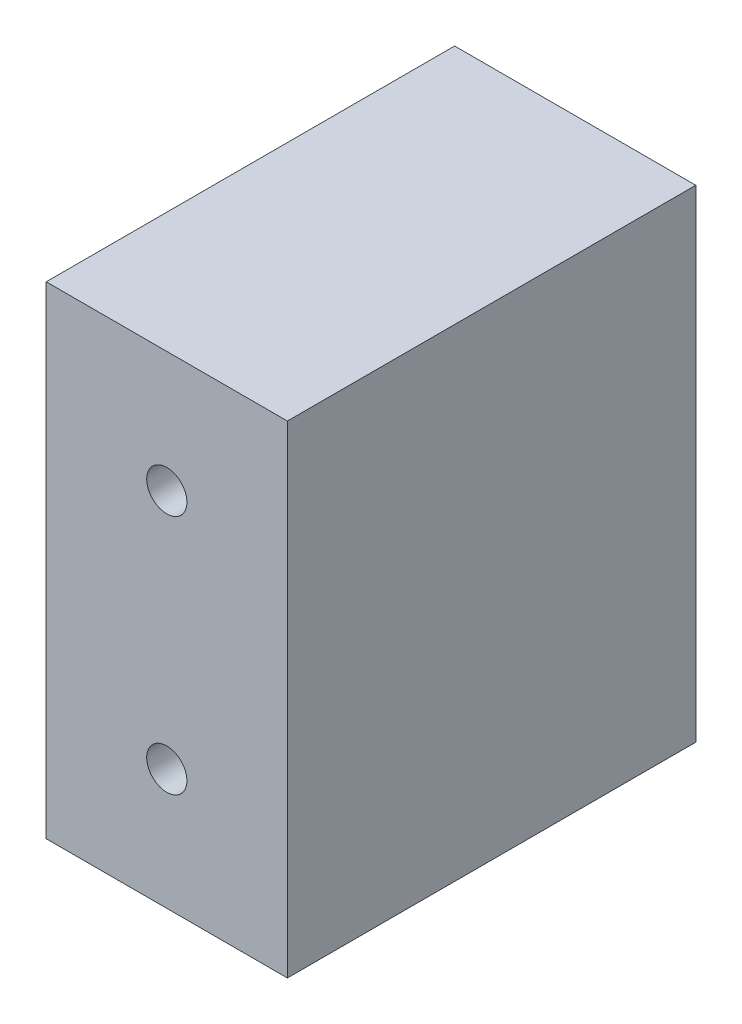
from build123d import *

# Parameters (mm, degrees)
SKETCH1_W           = 15
SKETCH1_H           = 30
SKETCH1_R           = 1.25
BOSS_EXTRUDE1_DEPTH = 25.4


with BuildPart() as part:
    # Sketch1 → Boss-Extrude1 (new body)
    with BuildSketch(Plane.XY):
        with Locations((0.881201044, -8.165796345)):
            Rectangle(SKETCH1_W, SKETCH1_H)
        with Locations((0.881201044, -0.665796345)):
            Circle(SKETCH1_R, mode=Mode.SUBTRACT)
        with Locations((0.881201044, -15.665796345)):
            Circle(SKETCH1_R, mode=Mode.SUBTRACT)
    extrude(amount=BOSS_EXTRUDE1_DEPTH)


solid = part.part
